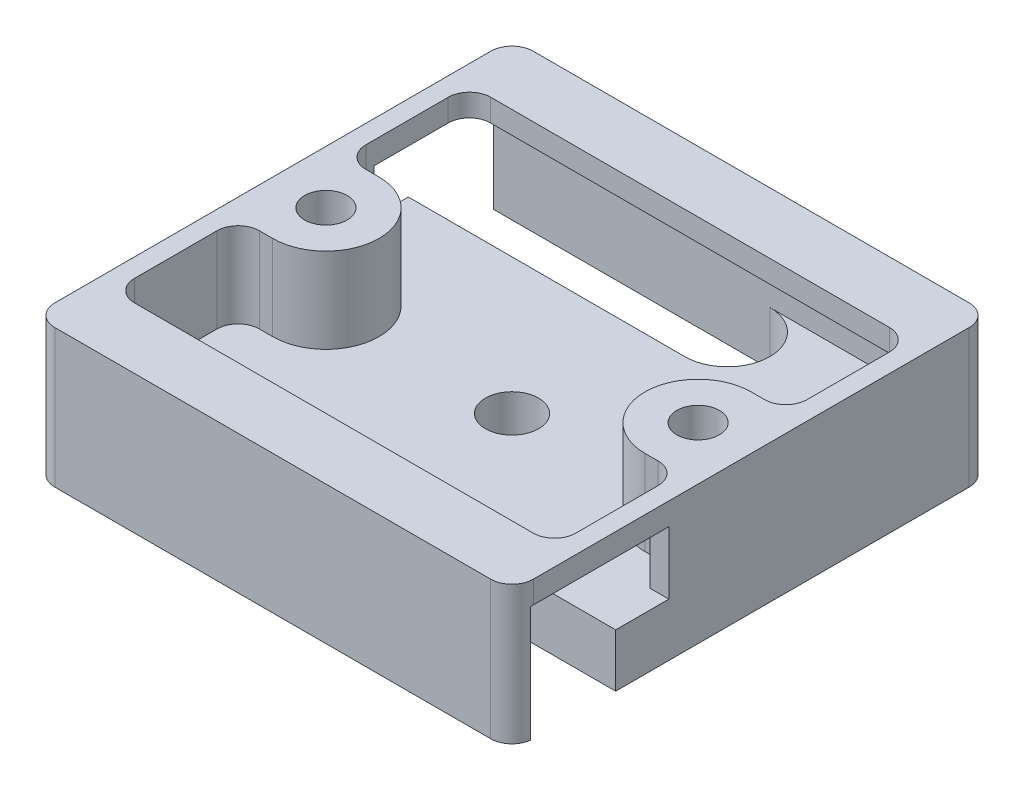
from build123d import *

# Parameters (mm, degrees)
CROQUIS1_R                   = 2.5
SALIENTE_EXTRUIR1_DEPTH      = 5
SALIENTE_EXTRUIR2_DEPTH      = 6
SALIENTE_EXTRUIR5_DEPTH      = 2
SALIENTE_EXTRUIR5_DEPTH_BACK = 0.1
CROQUIS2_W                   = 41.5
CROQUIS2_H                   = 5.75
CROQUIS2_H_2                 = 4
CROQUIS2_H_3                 = 1.75
CROQUIS2_W_2                 = 1.75
CROQUIS3_R                   = 2
SALIENTE_EXTRUIR6_DEPTH      = 8
CORTAR_EXTRUIR1_REACH        = 36.373
CORTAR_EXTRUIR2_START        = -3
CROQUIS4_R                   = 3.5
CROQUIS4_R_2                 = 2
CORTAR_EXTRUIR2_DEPTH        = 3
REDONDEO1_R                  = 2
REDONDEO2_R                  = 2


with BuildPart() as part:
    # Croquis1 → Saliente-Extruir1 (new body)
    with BuildSketch(Plane(origin=(0, 0, 0), x_dir=(1, 0, 0), z_dir=(0, 1, 0))):
        with BuildLine():
            Line((-22.5, -22.5), (22.5, -22.5))
            Line((22.5, -22.5), (22.5, -20.75))
            Line((22.5, -20.75), (-3.5, -20.75))
            ThreePointArc((-3.5, -20.75), (-7.5, -16.75), (-3.5, -12.75))
            Line((-3.5, -12.75), (22.5, -12.75))
            Line((22.5, -12.75), (22.5, 22.5))
            Line((22.5, 22.5), (-22.5, 22.5))
            Line((-22.5, 22.5), (-22.5, 20.75))
            Line((-22.5, 20.75), (3.5, 20.75))
            ThreePointArc((3.5, 20.75), (7.5, 16.75), (3.5, 12.75))
            Line((3.5, 12.75), (-22.5, 12.75))
            Line((-22.5, 12.75), (-22.5, -22.5))
        make_face()
        with Locations(Location((0, 0, 0), (0, 0, 270))):
            Circle(CROQUIS1_R, mode=Mode.SUBTRACT)
    extrude(amount=-SALIENTE_EXTRUIR1_DEPTH)

    # Croquis1<3> → Saliente-Extruir2 (add)
    with BuildSketch(Plane(origin=(0, 0, 0), x_dir=(1, 0, 0), z_dir=(0, 1, 0))):
        Polygon((-22.5, 7.75), (-22.5, -22.5), (22.5, -22.5), (22.5, -20.75), (-3.5, -20.75), (-20.75, -20.75), (-20.75, 7.75), align=None)
        Polygon((-22.5, 22.5), (-22.5, 20.75), (3.5, 20.75), (20.75, 20.75), (20.75, -7.75), (22.5, -7.75), (22.5, 22.5), align=None)
    extrude(amount=SALIENTE_EXTRUIR2_DEPTH)

    # Croquis2 → Saliente-Extruir5 (add, two sides: drawn at the far end of the back side and taken through both)
    with BuildSketch(Plane(origin=(0, 6, 0), x_dir=(1, 0, 0), z_dir=(0, 1, 0)).offset(-SALIENTE_EXTRUIR5_DEPTH_BACK)):
        with Locations((0, 19.625)):
            Rectangle(CROQUIS2_W, CROQUIS2_H)
        Polygon((-20.75, 22.5), (-22.5, 22.5), (-22.5, 7.75), (-20.75, 7.75), (-20.75, 16.75), align=None)
        with Locations((0, -18.75)):
            Rectangle(CROQUIS2_W, CROQUIS2_H_2)
        with Locations((0, -21.625)):
            Rectangle(CROQUIS2_W, CROQUIS2_H_3)
        Polygon((-20.75, 7.75), (-22.5, 7.75), (-22.5, -22.5), (-20.75, -22.5), (-20.75, -20.75), (-20.75, -16.75), align=None)
        Polygon((22.5, 22.5), (20.75, 22.5), (20.75, 16.75), (20.75, -16.75), (20.75, -20.75), (22.5, -20.75), align=None)
        with Locations((21.625, -21.625)):
            Rectangle(CROQUIS2_W_2, CROQUIS2_H_3)
    extrude(amount=SALIENTE_EXTRUIR5_DEPTH + SALIENTE_EXTRUIR5_DEPTH_BACK)

    # Croquis3 → Saliente-Extruir6 (add)
    with BuildSketch(Plane(origin=(0, 8, 0), x_dir=(1, 0, 0), z_dir=(0, 1, 0))):
        with BuildLine():
            Line((-20.75, 5), (-20.75, -5))
            Line((-20.75, -5), (-17.5, -5))
            Line((-17.5, -5), (-17.5, -2))
            ThreePointArc((-17.5, -2), (-19.5, 0), (-17.5, 2))
            Line((-17.5, 2), (-17.5, 5))
            Line((-17.5, 5), (-20.75, 5))
        make_face()
        with Locations((-17.5, 0)):
            Circle(CROQUIS3_R)
        with BuildLine():
            Line((-17.5, -5), (-17.5, 5))
            ThreePointArc((-17.5, 5), (-12.5, 0), (-17.5, -5))
        make_face()
        with BuildLine():
            ThreePointArc((-17.5, 2), (-19.5, 0), (-17.5, -2))
            Line((-17.5, -2), (-17.5, 2))
        make_face()
        with BuildLine():
            Line((-17.5, 2), (-17.5, -2))
            ThreePointArc((-17.5, -2), (-16.085786438, -1.414213562), (-15.5, 0))
            ThreePointArc((-15.5, 0), (-16.085786438, 1.414213562), (-17.5, 2))
        make_face()
    saliente_extruir6 = extrude(amount=-SALIENTE_EXTRUIR6_DEPTH)

    # Croquis3<3> → Cortar-Extruir1 (cut, up to next)
    with BuildSketch(Plane(origin=(0, 8, 0), x_dir=(1, 0, 0), z_dir=(0, 1, 0)), mode=Mode.PRIVATE) as cortar_extruir1_sk1:
        with BuildLine():
            ThreePointArc((-17.5, 2), (-19.5, 0), (-17.5, -2))
            Line((-17.5, -2), (-17.5, 2))
        make_face()
    cortar_extruir1_tool1 = extrude(cortar_extruir1_sk1.sketch, amount=-CORTAR_EXTRUIR1_REACH, mode=Mode.PRIVATE) & part.part
    # Croquis3<3> → Cortar-Extruir1 (cut, up to next)
    with BuildSketch(Plane(origin=(0, 8, 0), x_dir=(1, 0, 0), z_dir=(0, 1, 0)), mode=Mode.PRIVATE) as cortar_extruir1_sk2:
        with BuildLine():
            Line((-17.5, 2), (-17.5, -2))
            ThreePointArc((-17.5, -2), (-16.085786438, -1.414213562), (-15.5, 0))
            ThreePointArc((-15.5, 0), (-16.085786438, 1.414213562), (-17.5, 2))
        make_face()
    cortar_extruir1_tool2 = extrude(cortar_extruir1_sk2.sketch, amount=-CORTAR_EXTRUIR1_REACH, mode=Mode.PRIVATE) & part.part
    # Croquis3<3> → Cortar-Extruir1 (cut, up to next)
    with BuildSketch(Plane(origin=(0, 8, 0), x_dir=(1, 0, 0), z_dir=(0, 1, 0)), mode=Mode.PRIVATE) as cortar_extruir1_sk3:
        with BuildLine():
            ThreePointArc((-17.5, 2), (-19.5, 0), (-17.5, -2))
            Line((-17.5, -2), (-17.5, 2))
        make_face()
    cortar_extruir1_tool3 = extrude(cortar_extruir1_sk3.sketch, amount=-CORTAR_EXTRUIR1_REACH, mode=Mode.PRIVATE) & part.part
    # Croquis3<3> → Cortar-Extruir1 (cut, up to next)
    with BuildSketch(Plane(origin=(0, 8, 0), x_dir=(1, 0, 0), z_dir=(0, 1, 0)), mode=Mode.PRIVATE) as cortar_extruir1_sk4:
        with BuildLine():
            Line((-17.5, 2), (-17.5, -2))
            ThreePointArc((-17.5, -2), (-16.085786438, -1.414213562), (-15.5, 0))
            ThreePointArc((-15.5, 0), (-16.085786438, 1.414213562), (-17.5, 2))
        make_face()
    cortar_extruir1_tool4 = extrude(cortar_extruir1_sk4.sketch, amount=-CORTAR_EXTRUIR1_REACH, mode=Mode.PRIVATE) & part.part
    cortar_extruir1_1 = cortar_extruir1_tool1.solids().sort_by_distance((-18.348826, 8, 0))[0]
    add(cortar_extruir1_1, mode=Mode.SUBTRACT)
    cortar_extruir1_2 = cortar_extruir1_tool2.solids().sort_by_distance((-16.651174, 8, 0))[0]
    add(cortar_extruir1_2, mode=Mode.SUBTRACT)
    cortar_extruir1_3 = cortar_extruir1_tool3.solids().sort_by_distance((-18.348826, 8, 0))[0]
    add(cortar_extruir1_3, mode=Mode.SUBTRACT)
    cortar_extruir1_4 = cortar_extruir1_tool4.solids().sort_by_distance((-16.651174, 8, 0))[0]
    add(cortar_extruir1_4, mode=Mode.SUBTRACT)
    cortar_extruir1 = cortar_extruir1_1 + cortar_extruir1_2 + cortar_extruir1_3 + cortar_extruir1_4  # Cortar-Extruir1 as one shape, for the pattern or mirror that repeats it

    # Simetría1: Saliente-Extruir6, Cortar-Extruir1 across plane
    add(saliente_extruir6.mirror(Plane(origin=(0, 0, 0), x_dir=(0, 0, 1), z_dir=(1, 0, 0))))
    add(cortar_extruir1.mirror(Plane(origin=(0, 0, 0), x_dir=(0, 0, 1), z_dir=(1, 0, 0))), mode=Mode.SUBTRACT)

    # Croquis4 → Cortar-Extruir2 (cut)
    # profile 1 of 2: a face of its own
    with BuildSketch(Plane.XZ.offset(5).offset(CORTAR_EXTRUIR2_START)):
        with Locations(Location((-17.5, 0, 0), (0, 0, 270))):
            Circle(CROQUIS4_R)
        with Locations(Location((-17.5, 0, 0), (0, 0, 90))):
            Circle(CROQUIS4_R_2, mode=Mode.SUBTRACT)
    # profile 2 of 2: a face of its own
    with BuildSketch(Plane.XZ.offset(5).offset(CORTAR_EXTRUIR2_START)):
        with Locations(Location((17.5, 0, 0), (0, 0, 270))):
            Circle(CROQUIS4_R)
        with Locations(Location((17.5, 0, 0), (0, 0, 90))):
            Circle(CROQUIS4_R_2, mode=Mode.SUBTRACT)
    extrude(amount=CORTAR_EXTRUIR2_DEPTH, mode=Mode.SUBTRACT)

    # Redondeo1
    redondeo1_edges = [part.edges().sort_by_distance(p)[0] for p in [
        (20.75, 6.95, 16.75),
        (-20.75, 6.95, 16.75),
        (20.75, 6.95, -16.75),
        (-20.75, 4, -5),
        (-20.75, 4, 5),
        (20.75, 4, 5),
        (20.75, 4, -5),
        (-20.75, 6.95, -16.75),
    ]]
    fillet(redondeo1_edges, radius=REDONDEO1_R)

    # Redondeo2
    redondeo2_edges = [part.edges().sort_by_distance(p)[0] for p in [
        (-22.5, 1.5, -22.5),
        (22.5, 1.5, -22.5),
        (-22.5, 1.5, 22.5),
        (22.5, 1.5, 22.5),
        (20.75, 2.95, -20.75),
        (-20.75, 2.95, 20.75),
    ]]
    fillet(redondeo2_edges, radius=REDONDEO2_R)


solid = part.part
